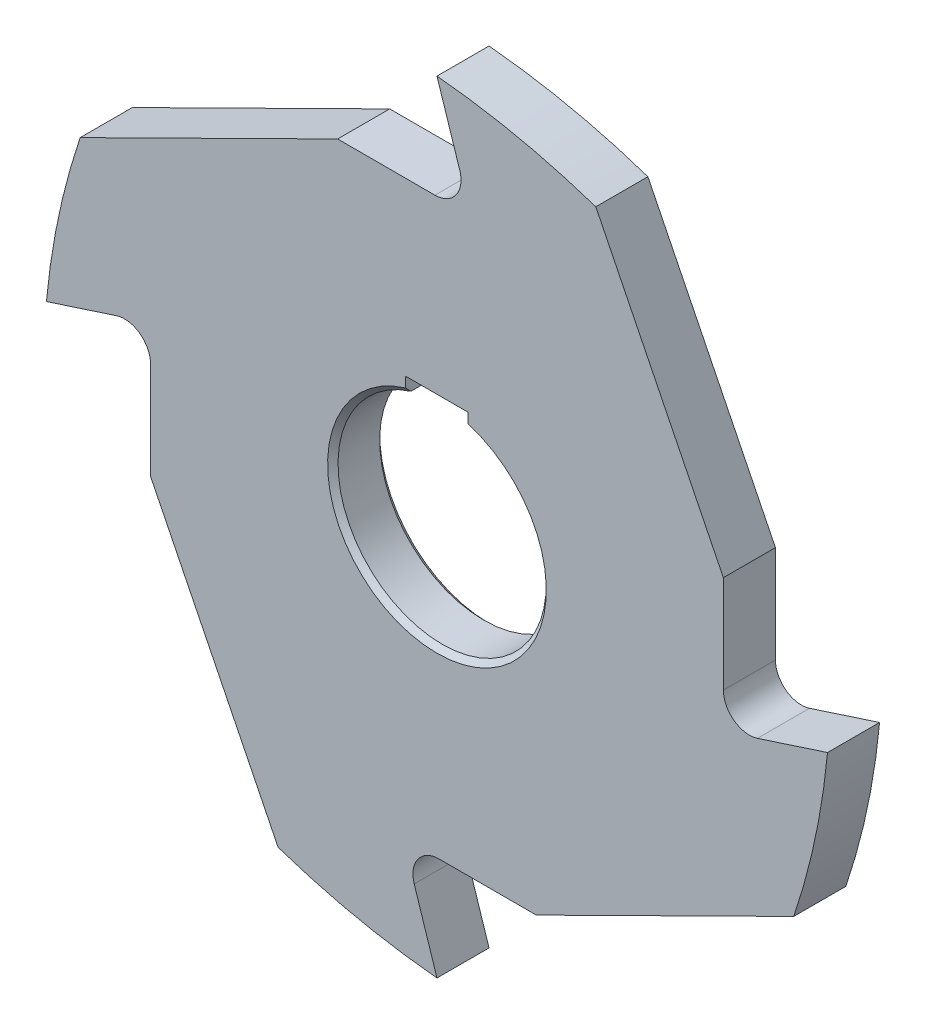
from build123d import *

# Parameters (mm, degrees)
BOSS_EXTRUDE1_DEPTH = 10
CHAMFER1_SIZE       = 1


with BuildPart() as part:
    # Sketch1 → Boss-Extrude1 (new body)
    with BuildSketch(Plane.XY):
        with BuildLine():
            ThreePointArc((4.371766904, 61.545084972), (3.661569294, 57.061073739), (-0.383515678, 55))
            Line((-0.383515678, 55), (-19.078784028, 55))
            Line((-19.078784028, 55), (-68.515909323, 30.505248231))
            ThreePointArc((-68.515909323, 30.505248231), (-72.64180115, 15.440491486), (-75, 0))
            Line((-75, 0), (-61.545084972, 4.371766904))
            ThreePointArc((-61.545084972, 4.371766904), (-57.061073739, 3.661569294), (-55, -0.383515678))
            Line((-55, -0.383515678), (-55, -19.078784028))
            Line((-55, -19.078784028), (-30.505248231, -68.515909323))
            ThreePointArc((-30.505248231, -68.515909323), (-15.440491486, -72.64180115), (0, -75))
            Line((0, -75), (-4.371766904, -61.545084972))
            ThreePointArc((-4.371766904, -61.545084972), (-3.661569294, -57.061073739), (0.383515678, -55))
            Line((0.383515678, -55), (19.078784028, -55))
            Line((19.078784028, -55), (68.515909323, -30.505248231))
            ThreePointArc((68.515909323, -30.505248231), (72.64180115, -15.440491486), (75, 0))
            Line((75, 0), (61.545084972, -4.371766904))
            ThreePointArc((61.545084972, -4.371766904), (57.061073739, -3.661569294), (55, 0.383515678))
            Line((55, 0.383515678), (55, 19.078784028))
            Line((55, 19.078784028), (30.505248231, 68.515909323))
            ThreePointArc((30.505248231, 68.515909323), (15.440491486, 72.64180115), (0, 75))
            Line((0, 75), (4.371766904, 61.545084972))
        make_face()
        with BuildLine():
            Line((-6, 19.078784028), (-6, 22.078784028))
            Line((-6, 22.078784028), (6, 22.078784028))
            Line((6, 22.078784028), (6, 19.078784028))
            ThreePointArc((6, 19.078784028), (0, -20), (-6, 19.078784028))
        make_face(mode=Mode.SUBTRACT)
    extrude(amount=-BOSS_EXTRUDE1_DEPTH)

    # Chamfer1
    chamfer1_edges = [part.edges().sort_by_distance(p)[0] for p in [
        (0, -20, 0),
        (0, -20, -10),
    ]]
    chamfer(chamfer1_edges, length=CHAMFER1_SIZE)


solid = part.part
